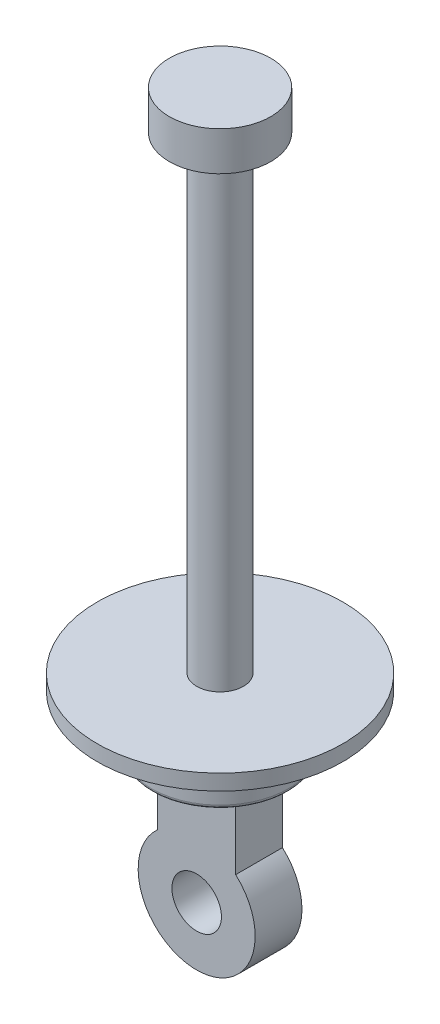
from build123d import *
from build123d.topology import SkipClean

# Parameters (mm, degrees)
BOSS_EXTRUDE1_DEPTH = 6
SKETCH2_R           = 6.35
CUT_EXTRUDE1_DEPTH  = 36.623026261
CUT_EXTRUDE2_DEPTH  = 36.623026261
SKETCH4_R           = 17.5
BOSS_EXTRUDE2_DEPTH = 10
FILLET3_R           = 1
FILLET4_R           = 2
SKETCH6_R           = 6
BOSS_EXTRUDE3_DEPTH = 130
SKETCH7_R           = 13
BOSS_EXTRUDE4_DEPTH = 10


with BuildPart() as part:
    # Sketch1 → Boss-Extrude1 (new, symmetric)
    with BuildSketch(Plane.XY):
        with BuildLine():
            Line((-15, 15), (15, 15))
            Line((15, 15), (15, -15))
            ThreePointArc((15, -15), (0, -30), (-15, -15))
            Line((-15, -15), (-15, 15))
        make_face()
    extrude(amount=BOSS_EXTRUDE1_DEPTH, both=True)

    # Sketch2 → Cut-Extrude1 (cut, through all)
    with BuildSketch(Plane.XY.offset(6)):
        with Locations((0, -15)):
            Circle(SKETCH2_R)
    extrude(amount=-CUT_EXTRUDE1_DEPTH, mode=Mode.SUBTRACT)

    # Sketch3 → Cut-Extrude2 (cut, through all)
    with SkipClean():  # the faces are left unmerged after this step: merging them gives an invalid solid
        with BuildSketch(Plane.XY.offset(6)):
            with BuildLine():
                Line((-10, -3.819660113), (-10, 15))
                Line((-10, 15), (-15, 15))
                Line((-15, 15), (-15, -15))
                ThreePointArc((-15, -15), (-13.693063938, -8.876275643), (-10, -3.819660113))
            make_face()
            with BuildLine():
                Line((15, 15), (15, -15))
                ThreePointArc((15, -15), (13.693063938, -8.876275643), (10, -3.819660113))
                Line((10, -3.819660113), (10, 15))
                Line((10, 15), (15, 15))
            make_face()
        extrude(amount=-CUT_EXTRUDE2_DEPTH, mode=Mode.SUBTRACT)

    # Sketch4 → Boss-Extrude2 (add)
    with BuildSketch(Plane(origin=(0, 15, 0), x_dir=(1, 0, 0), z_dir=(0, 1, 0))):
        with Locations(Location((0, 0, 0), (0, 0, 270))):
            Circle(SKETCH4_R)
    extrude(amount=BOSS_EXTRUDE2_DEPTH)

    # Fillet3
    fillet3_edges = [part.edges().sort_by_distance(p)[0] for p in [
        (0, 15, -17.5),
    ]]
    fillet(fillet3_edges, radius=FILLET3_R)

    # Fillet4
    fillet4_edges = [part.edges().sort_by_distance(p)[0] for p in [
        (-10, 15, 0),
        (0, 15, -6),
        (0, 15, 6),
        (10, 15, 0),
    ]]
    fillet(fillet4_edges, radius=FILLET4_R)

    # Sketch5 → Revolve1 (revolve)
    with BuildSketch(Plane(origin=(0, 0, 0), x_dir=(0, 0, -1), z_dir=(1, 0, 0)), mode=Mode.PRIVATE) as revolve1_sk:
        Polygon((0, 25), (-22.5, 25), (-31.5, 29), (-31.5, 33), (0, 33), align=None)
    revolve(revolve1_sk.sketch.rotate(Axis((0, 0, 0), (0, 1, 0)), 180), axis=Axis((0, 0, 0), (0, 1, 0)))

    # Sketch6 → Boss-Extrude3 (add)
    with BuildSketch(Plane(origin=(0, 33, 0), x_dir=(1, 0, 0), z_dir=(0, 1, 0))):
        with Locations(Location((0, 0, 0), (0, 0, 90))):
            Circle(SKETCH6_R)
    extrude(amount=BOSS_EXTRUDE3_DEPTH)

    # Sketch7 → Boss-Extrude4 (add)
    with BuildSketch(Plane(origin=(0, 163, 0), x_dir=(1, 0, 0), z_dir=(0, 1, 0))):
        with Locations(Location((0, 0, 0), (0, 0, 270))):
            Circle(SKETCH7_R)
    extrude(amount=-BOSS_EXTRUDE4_DEPTH)


solid = part.part
